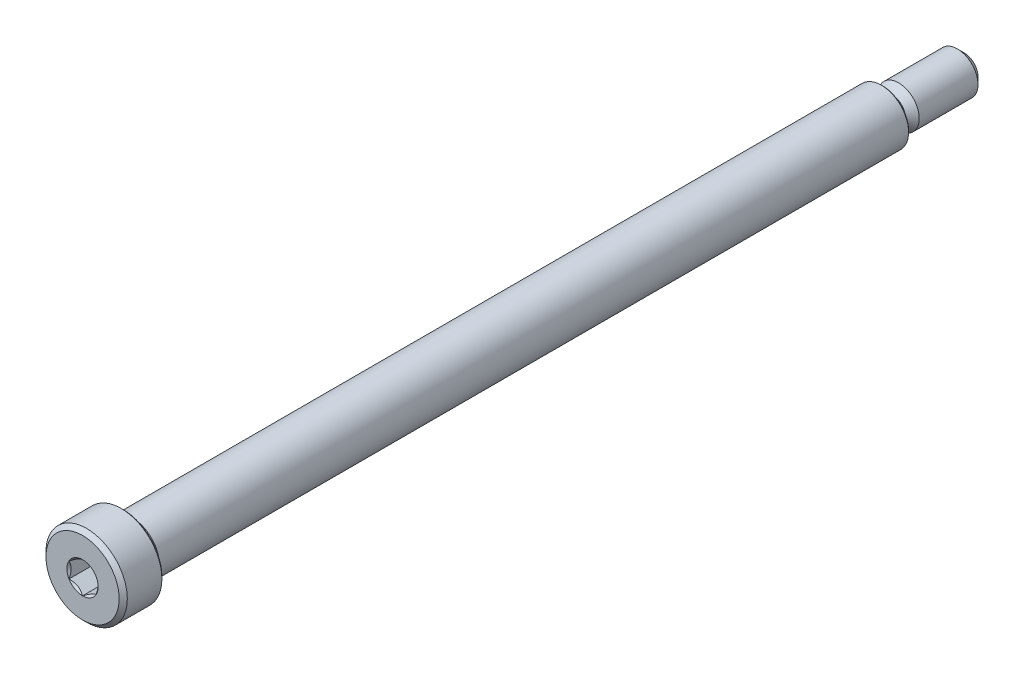
from build123d import *

# Parameters (mm, degrees)
CUT_EXTRUDE1_DEPTH = 3.095625


with BuildPart() as part:
    # Sketch3 → Revolve1 (revolve)
    with BuildSketch(Plane(origin=(0, 0, 0), x_dir=(0, 0, -1), z_dir=(1, 0, 0)), mode=Mode.PRIVATE) as revolve1_sk:
        with BuildLine():
            Line((-51.59375, 0), (-51.59375, 4.28625))
            Line((-51.59375, 4.28625), (-51.1175, 4.7625))
            Line((-51.1175, 4.7625), (-47.069375, 4.7625))
            Line((-47.069375, 4.7625), (-46.83125, 4.524375))
            Line((-46.83125, 4.524375), (-46.83125, 3.1353125))
            ThreePointArc((-46.83125, 3.1353125), (-46.796377401, 3.051122599), (-46.7121875, 3.01625))
            Line((-46.7121875, 3.01625), (-45.931666667, 3.01625))
            Line((-45.931666667, 3.01625), (-45.772916667, 3.175))
            Line((-45.772916667, 3.175), (41.91, 3.175))
            Line((41.91, 3.175), (42.06875, 3.01625))
            Line((42.06875, 3.01625), (42.06875, 2.016125))
            ThreePointArc((42.06875, 2.016125), (42.184991996, 1.735491996), (42.465625, 1.61925))
            Line((42.465625, 1.61925), (43.127083333, 1.61925))
            Line((43.127083333, 1.61925), (43.920833333, 2.413))
            Line((43.920833333, 2.413), (50.8, 2.413))
            Line((50.8, 2.413), (51.59375, 1.61925))
            Line((51.59375, 1.61925), (51.59375, 0))
            Line((51.59375, 0), (-51.59375, 0))
        make_face()
    revolve(revolve1_sk.sketch.rotate(Axis((0, 0, 51.59375), (0, 0, -1)), 90), axis=Axis((0, 0, 51.59375), (0, 0, -1)))

    # Sketch4 → Cut-Extrude1 (cut)
    with BuildSketch(Plane.XY.offset(51.59375)):
        Polygon((-1.5875, -0.916543552), (0, -1.833087105), (1.5875, -0.916543552), (1.5875, 0.916543552), (0, 1.833087105), (-1.5875, 0.916543552), align=None)
    extrude(amount=-CUT_EXTRUDE1_DEPTH, mode=Mode.SUBTRACT)

    # Cut-Extrude2 cone 1 section (through the dimple's axis) → Cut-Extrude2 (revolve, cut)
    with BuildSketch(Plane(origin=(0, 0, 51.59375), x_dir=(0, -1, 0), z_dir=(1, 0, 0))):
        Polygon((0, 0), (1.833087105, 0), (0, 1.833087105), align=None)
    revolve(axis=Axis((0, 0, 51.59375), (0, 0, -1)), mode=Mode.SUBTRACT)


solid = part.part
